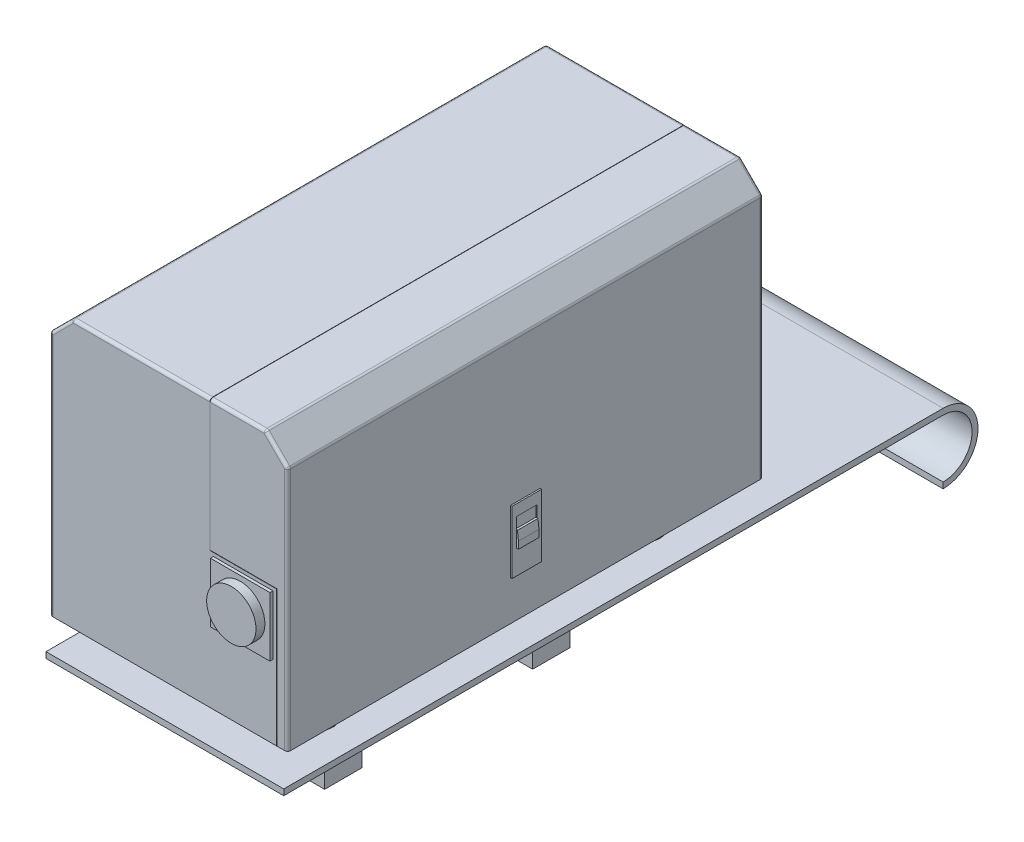
from build123d import *
from OCP.BRepFilletAPI import BRepFilletAPI_MakeChamfer

# Parameters (mm, degrees)
SKETCH_1_W               = 160
SKETCH_1_H               = 320
EXTRUDE_1_DEPTH          = 180
CUT_EXTRUDE_3_DEPTH      = 0.2
CUT_EXTRUDE_3_DEPTH_BACK = 376.765884561
CHAMFER_1_SIZE           = 15
CHAMFER_2_SIZE           = 15
FILLET_1_R               = 2
FILLET_2_R               = 2
SKETCH_3_W               = 19.82949963
SKETCH_3_H               = 42.177030959
EXTRUDE_2_DEPTH          = 1
SKETCH_4_W               = 13.804854044
SKETCH_4_H               = 18.566163121
CUT_EXTRUDE_2_DEPTH      = 0.8
SKETCH_5_W               = 40
SKETCH_5_H               = 40
EXTRUDE_3_DEPTH          = 2
SKETCH_6_R               = 16.60269393
EXTRUDE_4_DEPTH          = 6
SKETCH_7_R               = 12
EXTRUDE_5_DEPTH          = 20
CHAMFER_3_SIZE           = 14
CHAMFER_3_SIZE2          = 1.471459294
EXTRUDE_6_DEPTH          = 80
SKETCH_10_W              = 140
SKETCH_10_H              = 25
EXTRUDE_7_DEPTH          = 20
EXTRUDE_7_2_DEPTH        = 20
SKETCH_11_R              = 4
CUT_EXTRUDE_3_2_DEPTH    = 30
SKETCH_13_W              = 13.804854044
SKETCH_13_H              = 10.800130904
EXTRUDE_8_DEPTH          = 2
CHAMFER_4_SIZE           = 6
CHAMFER_4_SIZE2          = 0.630625412


with BuildPart() as part:
    # 草图1 → 凸台-拉伸1 (new body)
    with BuildSketch(Plane(origin=(0, 0, 0), x_dir=(1, 0, 0), z_dir=(0, 1, 0))):
        Rectangle(SKETCH_1_W, SKETCH_1_H)
    extrude(amount=EXTRUDE_1_DEPTH)

    # 草图2 → Cut-Extrude 3 (cut, two sides: drawn at the far end of the back side and taken through both)
    with BuildSketch(Plane.XY.offset(160).offset(-CUT_EXTRUDE_3_DEPTH_BACK)):
        Polygon((27.867220045, 180), (27.867220045, 91.72383251), (72.707594266, 91.72383251), (72.707594266, 0), (72.507594266, 0), (72.507594266, 91.52383251), (27.667220045, 91.52383251), (27.667220045, 180), align=None)
    extrude(amount=CUT_EXTRUDE_3_DEPTH + CUT_EXTRUDE_3_DEPTH_BACK, mode=Mode.SUBTRACT)


with BuildPart() as cut_extrude_3_piece_1:
    # of the separate pieces the step leaves, piece 1, a body of its own (cut_extrude_3_pieces)
    add(part.part.solids().sort_by_distance((-80, 0, 160))[0])

    # 倒角2
    chamfer_2_edges = [cut_extrude_3_piece_1.edges().sort_by_distance(p)[0] for p in [
        (-80, 180, 0),
    ]]
    chamfer(chamfer_2_edges, length=CHAMFER_2_SIZE)

    # 圆角2
    fillet_2_edges = [cut_extrude_3_piece_1.edges().sort_by_distance(p)[0] for p in [
        (-18.666389977, 180, 160),
        (-65, 180, 0),
        (-80, 82.5, 160),
        (-72.5, 172.5, 160),
        (-80, 82.5, -160),
        (-80, 165, 0),
        (-72.5, 172.5, -160),
        (-18.666389977, 180, -160),
    ]]
    fillet(fillet_2_edges, radius=FILLET_2_R)

    # 草图5 → 凸台-拉伸3 (add)
    with BuildSketch(Plane.XY.offset(160)):
        with Locations((50.087407156, 69.161685825)):
            Rectangle(SKETCH_5_W, SKETCH_5_H)
    extrude(amount=EXTRUDE_3_DEPTH)

    # 草图6 → 凸台-拉伸4 (add)
    with BuildSketch(Plane.XY.offset(162)):
        with Locations(Location((50.087407156, 69.161685825, 0), (0, 0, 180))):
            Circle(SKETCH_6_R)
    extrude(amount=EXTRUDE_4_DEPTH)

    # 草图7 → 凸台-拉伸5 (add)
    with BuildSketch(Plane.XZ):
        with Locations(Location((-50, 110, 0), (0, 0, 270))):
            Circle(SKETCH_7_R)
        with Locations(Location((50, 110, 0), (0, 0, 270))):
            Circle(SKETCH_7_R)
        with Locations(Location((-50, -110, 0), (0, 0, 270))):
            Circle(SKETCH_7_R)
        with Locations(Location((50, -110, 0), (0, 0, 270))):
            Circle(SKETCH_7_R)
    extrude(amount=EXTRUDE_5_DEPTH)

    # 倒角3: one chamfer whose edges measure the first distance from different faces: ONE call of the kernel's chamfer builder (chamfer() names one face for all edges)
    chamfer_3_edges_1 = [cut_extrude_3_piece_1.edges().sort_by_distance(p)[0] for p in [
        (-50, -20, 122),
    ]]
    chamfer_3_side_1 = [cut_extrude_3_piece_1.faces().sort_by_distance(p)[0] for p in [
        (-50, -10, 122),
    ]]
    chamfer_3_edges_2 = [cut_extrude_3_piece_1.edges().sort_by_distance(p)[0] for p in [
        (50, -20, 122),
    ]]
    chamfer_3_side_2 = [cut_extrude_3_piece_1.faces().sort_by_distance(p)[0] for p in [
        (50, -10, 122),
    ]]
    chamfer_3_edges_3 = [cut_extrude_3_piece_1.edges().sort_by_distance(p)[0] for p in [
        (-50, -20, -98),
    ]]
    chamfer_3_side_3 = [cut_extrude_3_piece_1.faces().sort_by_distance(p)[0] for p in [
        (-50, -10, -98),
    ]]
    chamfer_3_edges_4 = [cut_extrude_3_piece_1.edges().sort_by_distance(p)[0] for p in [
        (50, -20, -98),
    ]]
    chamfer_3_side_4 = [cut_extrude_3_piece_1.faces().sort_by_distance(p)[0] for p in [
        (50, -10, -98),
    ]]
    chamfer_3 = BRepFilletAPI_MakeChamfer(cut_extrude_3_piece_1.part.solid().wrapped)
    for e in chamfer_3_edges_1:
        chamfer_3.Add(CHAMFER_3_SIZE, CHAMFER_3_SIZE2, e.wrapped, chamfer_3_side_1[0].wrapped)  # the first distance lies on this face
    for e in chamfer_3_edges_2:
        chamfer_3.Add(CHAMFER_3_SIZE, CHAMFER_3_SIZE2, e.wrapped, chamfer_3_side_2[0].wrapped)  # the first distance lies on this face
    for e in chamfer_3_edges_3:
        chamfer_3.Add(CHAMFER_3_SIZE, CHAMFER_3_SIZE2, e.wrapped, chamfer_3_side_3[0].wrapped)  # the first distance lies on this face
    for e in chamfer_3_edges_4:
        chamfer_3.Add(CHAMFER_3_SIZE, CHAMFER_3_SIZE2, e.wrapped, chamfer_3_side_4[0].wrapped)  # the first distance lies on this face
    add(Compound.cast(chamfer_3.Shape()), mode=Mode.REPLACE)


with BuildPart() as cut_extrude_3_piece_2:
    # of the separate pieces the step leaves, piece 2, a body of its own (cut_extrude_3_pieces)
    add(part.part.solids().sort_by_distance((72.707594266, 0, 160))[0])

    # 倒角1
    chamfer_1_edges = [cut_extrude_3_piece_2.edges().sort_by_distance(p)[0] for p in [
        (80, 180, 0),
    ]]
    chamfer(chamfer_1_edges, length=CHAMFER_1_SIZE)

    # 圆角1
    fillet_1_edges = [cut_extrude_3_piece_2.edges().sort_by_distance(p)[0] for p in [
        (46.433610023, 180, 160),
        (46.433610023, 180, -160),
        (65, 180, 0),
        (80, 82.5, -160),
        (72.5, 172.5, -160),
        (80, 82.5, 160),
        (80, 165, 0),
        (72.5, 172.5, 160),
    ]]
    fillet(fillet_1_edges, radius=FILLET_1_R)


with BuildPart() as body_3:
    # 草图3 → 凸台-拉伸2 (new body)
    with BuildSketch(Plane(origin=(80, 0, 0), x_dir=(0, 0, -1), z_dir=(1, 0, 0))):
        with Locations((0, 47.82296904)):
            Rectangle(SKETCH_3_W, SKETCH_3_H)
    extrude(amount=EXTRUDE_2_DEPTH)

    # 草图4 → 切除-拉伸2 (cut)
    with BuildSketch(Plane(origin=(81, 0, 0), x_dir=(0, 0, -1), z_dir=(1, 0, 0))):
        with Locations((0, 52.160572655)):
            Rectangle(SKETCH_4_W, SKETCH_4_H)
    extrude(amount=-CUT_EXTRUDE_2_DEPTH, mode=Mode.SUBTRACT)

    # 草图13 → 凸台-拉伸8 (add)
    with BuildSketch(Plane(origin=(80.2, 0, 0), x_dir=(0, 0, -1), z_dir=(1, 0, 0))):
        with Locations((0, 48.277556546)):
            Rectangle(SKETCH_13_W, SKETCH_13_H)
    extrude(amount=EXTRUDE_8_DEPTH)

    # 倒角4
    chamfer_4_edges = [body_3.edges().sort_by_distance(p)[0] for p in [
        (82.2, 53.677621998, 0),
    ]]
    chamfer_4_side = [body_3.faces().sort_by_distance(p)[0] for p in [
        (82.2, 48.277556546, 0),
    ]]
    chamfer(chamfer_4_edges, length=CHAMFER_4_SIZE, length2=CHAMFER_4_SIZE2, reference=chamfer_4_side[0])


with BuildPart() as body_4:
    # 草图9 → 凸台-拉伸6 (new, symmetric)
    with BuildSketch(Plane(origin=(0, 0, 0), x_dir=(0, 0, -1), z_dir=(1, 0, 0))):
        with BuildLine():
            Line((-162.614551414, -20), (281.071104968, -20))
            ThreePointArc((281.071104968, -20), (304.565495633, -43.494390665), (281.071104968, -66.988781331))
            Line((281.071104968, -66.988781331), (281.071104968, -62.988781331))
            ThreePointArc((281.071104968, -62.988781331), (300.565495633, -43.494390665), (281.071104968, -24))
            Line((281.071104968, -24), (-162.614551414, -24))
            Line((-162.614551414, -24), (-162.614551414, -20))
        make_face()
    extrude(amount=EXTRUDE_6_DEPTH, both=True)


with BuildPart() as body_5:
    # 草图10 → 凸台-拉伸7 (new body)
    with BuildSketch(Plane.XZ.offset(24)):
        with Locations((0, 112.614551414)):
            Rectangle(SKETCH_10_W, SKETCH_10_H)
    extrude(amount=EXTRUDE_7_DEPTH)


with BuildPart() as body_6:
    # 草图10 → Extrude 7 2 (new body)
    with BuildSketch(Plane.XZ.offset(24)):
        with Locations((0, -27.385448586)):
            Rectangle(SKETCH_10_W, SKETCH_10_H)
    extrude(amount=EXTRUDE_7_2_DEPTH)


with BuildPart() as cut_extrude_3_2_tool:
    # 草图11 → Cut-Extrude 3 2 (new body)
    with BuildSketch(Plane.XZ.offset(44)):
        with Locations(Location((-30, 112.614551414, 0), (0, 0, 270))):
            Circle(SKETCH_11_R)
        with Locations(Location((30, 112.614551414, 0), (0, 0, 270))):
            Circle(SKETCH_11_R)
        with Locations(Location((30, -27.385448586, 0), (0, 0, 270))):
            Circle(SKETCH_11_R)
        with Locations(Location((-30, -27.385448586, 0), (0, 0, 270))):
            Circle(SKETCH_11_R)
    extrude(amount=-CUT_EXTRUDE_3_2_DEPTH)


with BuildPart() as body_6_1:
    add(body_6.part)

    # Cut-Extrude 3 2: cut by cut_extrude_3_2_tool
    add(cut_extrude_3_2_tool.part, mode=Mode.SUBTRACT)


with BuildPart() as body_5_1:
    add(body_5.part)

    # Cut-Extrude 3 2: cut by cut_extrude_3_2_tool
    add(cut_extrude_3_2_tool.part, mode=Mode.SUBTRACT)


solid = Compound([cut_extrude_3_piece_1.part, cut_extrude_3_piece_2.part, body_3.part, body_4.part, body_6_1.part, body_5_1.part])
